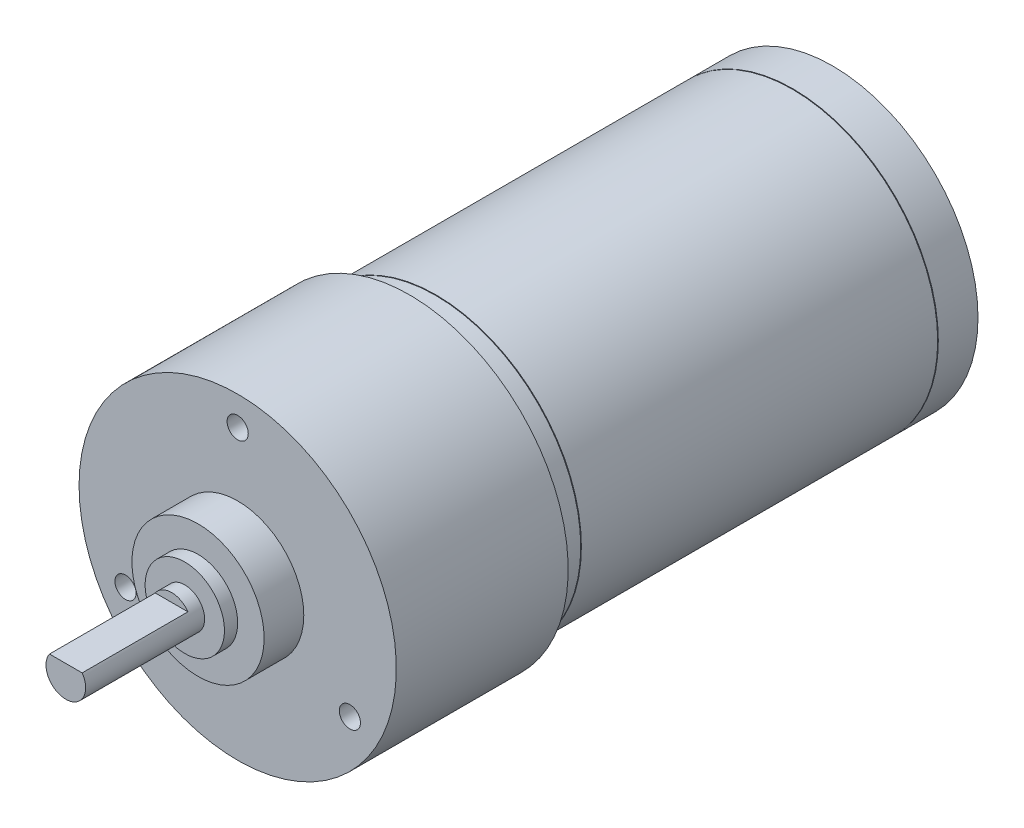
from build123d import *

# Parameters (mm, degrees)
SKETCH_1_R             = 11
EXTRUDE_1_DEPTH        = 32
HOLE_WIZARD_M2_1_D     = 1.6
HOLE_WIZARD_M2_1_DEPTH = 5.2
HOLE_WIZARD_M2_1_TIP   = 0.480688495
CUT_EXTRUDE_START      = -3
SKETCH_5_R             = 11.838448527
SKETCH_5_R_2           = 10.75
CUT_EXTRUDE_1_DEPTH    = 0.05
CUT_EXTRUDE_START_2    = -30
SKETCH_5_2_R           = 11.838448527
SKETCH_5_2_R_2         = 10.75
CUT_EXTRUDE_2_DEPTH    = 0.05
SKETCH_6_R             = 12
EXTRUDE_2_DEPTH        = 13
SKETCH_7_R             = 5
EXTRUDE_3_DEPTH        = 3
SKETCH_8_R             = 3
EXTRUDE_4_DEPTH        = 4
SKETCH_9_R             = 1.5
EXTRUDE_5_DEPTH        = 13
SKETCH_10_W            = 5.142844332
SKETCH_10_H            = 1.571012966
CUT_EXTRUDE_3_DEPTH    = 8
HOLE_WIZARD_M2_2_D     = 1.6
HOLE_WIZARD_M2_2_DEPTH = 5.2
HOLE_WIZARD_M2_2_TIP   = 0.480688495


with BuildPart() as part:
    # 草图1 → 凸台-拉伸1 (new body)
    with BuildSketch(Plane.XY):
        Circle(SKETCH_1_R)
    extrude(amount=EXTRUDE_1_DEPTH)

    # M2 螺纹孔1
    with Locations(Plane(origin=(0, 8.5, 32), x_dir=(1, 0, 0), z_dir=(0, 0, 1))):
        with Locations((0, 0), (0, -17)):
            Hole(HOLE_WIZARD_M2_1_D / 2, depth=HOLE_WIZARD_M2_1_DEPTH)
            with Locations((0, 0, -(HOLE_WIZARD_M2_1_DEPTH + HOLE_WIZARD_M2_1_TIP / 2))):  # 118° drill point
                Cone(0, HOLE_WIZARD_M2_1_D / 2, HOLE_WIZARD_M2_1_TIP, mode=Mode.SUBTRACT)

    # 草图5 → 切除-拉伸1 (cut)
    with BuildSketch(Plane(origin=(0, 0, 0), x_dir=(-1, 0, 0), z_dir=(0, 0, -1)).offset(CUT_EXTRUDE_START)):
        Circle(SKETCH_5_R)
        Circle(SKETCH_5_R_2, mode=Mode.SUBTRACT)
    extrude(amount=-CUT_EXTRUDE_1_DEPTH, mode=Mode.SUBTRACT)

    # 草图5<2> → 切除-拉伸2 (cut)
    with BuildSketch(Plane(origin=(0, 0, 0), x_dir=(-1, 0, 0), z_dir=(0, 0, -1)).offset(CUT_EXTRUDE_START_2)):
        Circle(SKETCH_5_2_R)
        Circle(SKETCH_5_2_R_2, mode=Mode.SUBTRACT)
    extrude(amount=-CUT_EXTRUDE_2_DEPTH, mode=Mode.SUBTRACT)

    # 草图6 → 凸台-拉伸2 (add)
    with BuildSketch(Plane.XY.offset(32)):
        Circle(SKETCH_6_R)
    extrude(amount=EXTRUDE_2_DEPTH)

    # 草图7 → 凸台-拉伸3 (add)
    with BuildSketch(Plane.XY.offset(45)):
        Circle(SKETCH_7_R)
    extrude(amount=EXTRUDE_3_DEPTH)

    # 草图8 → 凸台-拉伸4 (add)
    with BuildSketch(Plane.XY.offset(45)):
        Circle(SKETCH_8_R)
    extrude(amount=EXTRUDE_4_DEPTH)

    # 草图9 → 凸台-拉伸5 (add)
    with BuildSketch(Plane.XY.offset(45)):
        Circle(SKETCH_9_R)
    extrude(amount=EXTRUDE_5_DEPTH)

    # 草图10 → 切除-拉伸3 (cut)
    with BuildSketch(Plane.XY.offset(58)):
        with Locations((0.334320666, 1.635506483)):
            Rectangle(SKETCH_10_W, SKETCH_10_H)
    extrude(amount=-CUT_EXTRUDE_3_DEPTH, mode=Mode.SUBTRACT)

    # M2 螺纹孔2
    with Locations(Plane(origin=(0, 9.8, 45), x_dir=(1, 0, 0), z_dir=(0, 0, 1))):
        with Locations((0, 0), (8.487048957, -14.7), (-8.487048957, -14.7)):
            Hole(HOLE_WIZARD_M2_2_D / 2, depth=HOLE_WIZARD_M2_2_DEPTH)
            with Locations((0, 0, -(HOLE_WIZARD_M2_2_DEPTH + HOLE_WIZARD_M2_2_TIP / 2))):  # 118° drill point
                Cone(0, HOLE_WIZARD_M2_2_D / 2, HOLE_WIZARD_M2_2_TIP, mode=Mode.SUBTRACT)


solid = part.part
